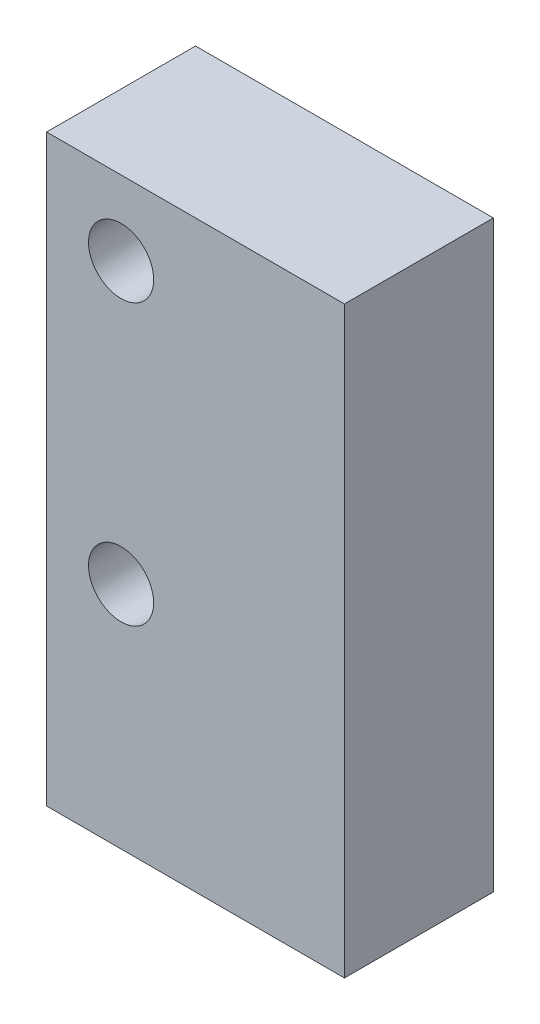
from build123d import *

# Parameters (mm, degrees)
SKETCH2_W           = 12.7
SKETCH2_H           = 24.892
SKETCH2_R           = 1.3890625
BOSS_EXTRUDE2_DEPTH = 6.35


with BuildPart() as part:
    # Sketch2 → Boss-Extrude2 (new body)
    with BuildSketch(Plane.XY):
        with Locations((6.35, 12.446)):
            Rectangle(SKETCH2_W, SKETCH2_H)
        with Locations((3.175, 9.779)):
            Circle(SKETCH2_R, mode=Mode.SUBTRACT)
        with Locations((3.175, 21.717)):
            Circle(SKETCH2_R, mode=Mode.SUBTRACT)
    extrude(amount=BOSS_EXTRUDE2_DEPTH)


solid = part.part
